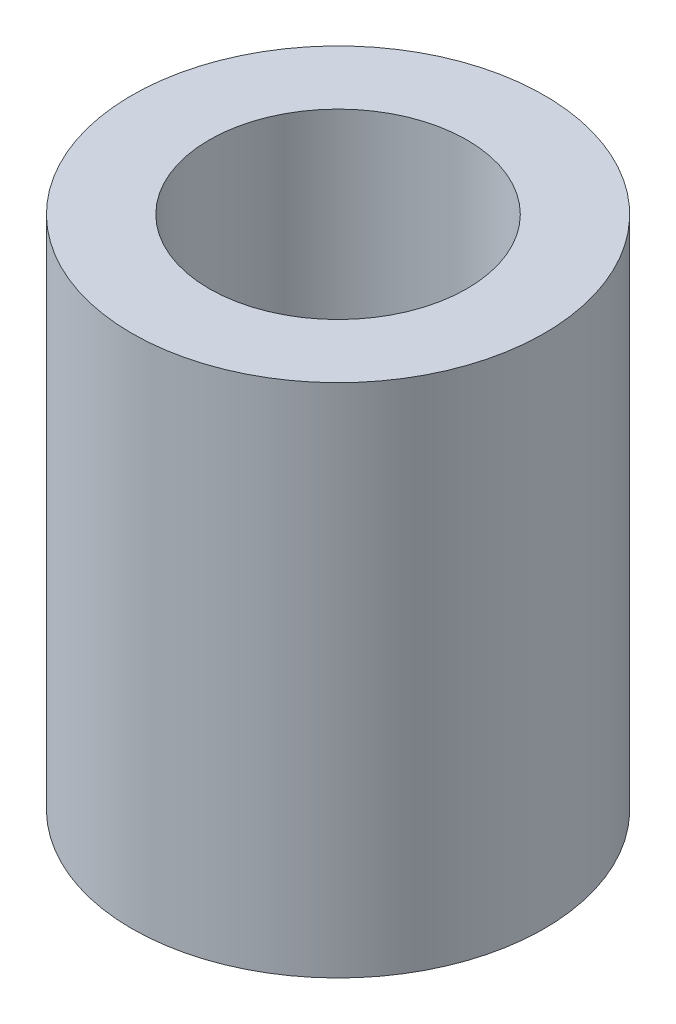
from build123d import *

# Parameters (mm, degrees)
SKETCH_1_R      = 2
SKETCH_1_R_2    = 1.25
EXTRUDE_1_DEPTH = 5


with BuildPart() as part:
    # 草图1 → 凸台-拉伸1 (new body)
    with BuildSketch(Plane(origin=(0, 0, 0), x_dir=(1, 0, 0), z_dir=(0, 1, 0))):
        with Locations(Location((0, 0, 0), (0, 0, 270))):
            Circle(SKETCH_1_R)
        with Locations(Location((0, 0, 0), (0, 0, 270))):
            Circle(SKETCH_1_R_2, mode=Mode.SUBTRACT)
    extrude(amount=EXTRUDE_1_DEPTH)


solid = part.part
